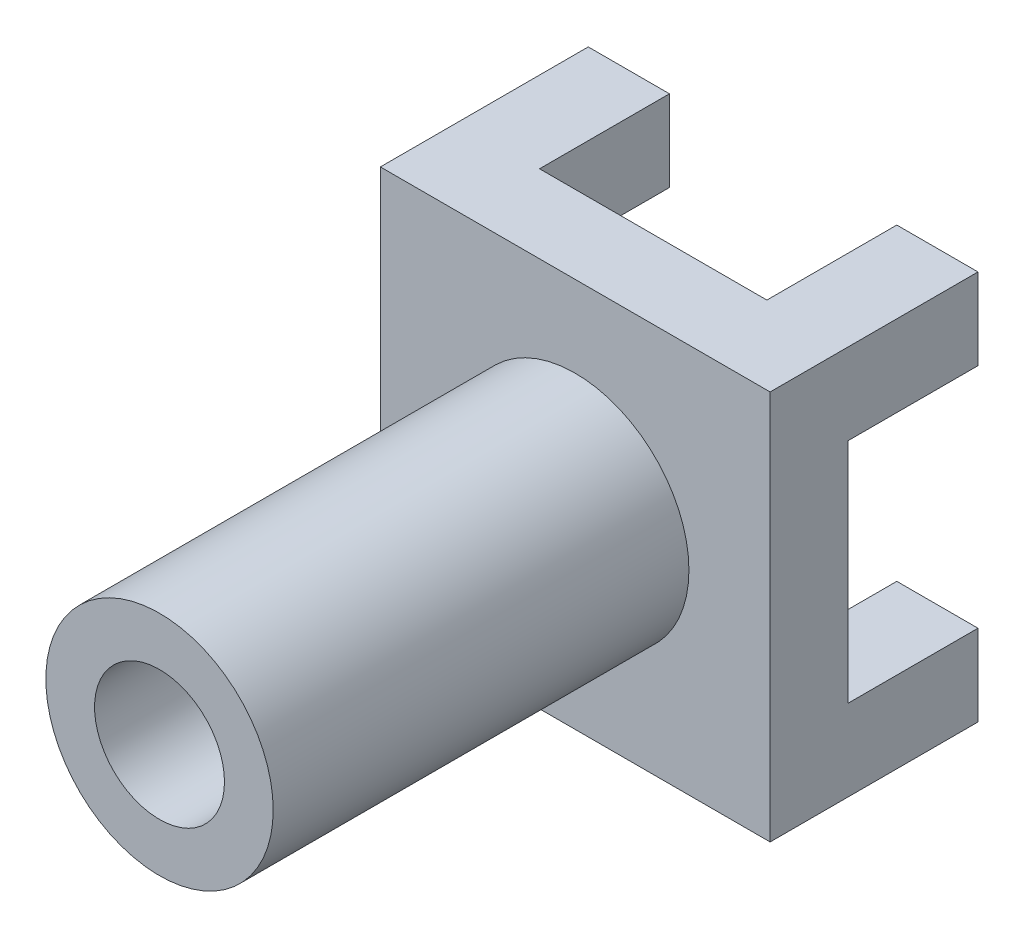
from build123d import *

# Parameters (mm, degrees)
CROQUIS1_W              = 60
CROQUIS1_H              = 60
SALIENTE_EXTRUIR1_DEPTH = 12
CROQUIS2_R              = 17.5
SALIENTE_EXTRUIR2_DEPTH = 64
CROQUIS7_R              = 10
CORTAR_EXTRUIR1_DEPTH   = 76
CROQUIS8_W              = 12.5
CROQUIS8_H              = 12.5
SALIENTE_EXTRUIR3_DEPTH = 20
CROQUIS11_W             = 12.5
CROQUIS11_H             = 12.5
SALIENTE_EXTRUIR5_DEPTH = 20
CROQUIS12_W             = 12.5
CROQUIS12_H             = 12.5
SALIENTE_EXTRUIR6_DEPTH = 20
CROQUIS9_W              = 12.5
CROQUIS9_H              = 12.5
SALIENTE_EXTRUIR9_DEPTH = 20


with BuildPart() as part:
    # Croquis1 → Saliente-Extruir1 (new body)
    with BuildSketch(Plane.XY):
        with Locations((30, 30)):
            Rectangle(CROQUIS1_W, CROQUIS1_H)
    extrude(amount=-SALIENTE_EXTRUIR1_DEPTH)

    # Croquis2 → Saliente-Extruir2 (add)
    with BuildSketch(Plane.XY):
        with Locations((30, 30)):
            Circle(CROQUIS2_R)
    extrude(amount=SALIENTE_EXTRUIR2_DEPTH)

    # Croquis7 → Cortar-Extruir1 (cut)
    with BuildSketch(Plane.XY.offset(64)):
        with Locations((30, 30)):
            Circle(CROQUIS7_R)
    extrude(amount=-CORTAR_EXTRUIR1_DEPTH, mode=Mode.SUBTRACT)

    # Croquis8 → Saliente-Extruir3 (add)
    with BuildSketch(Plane(origin=(0, 0, -12), x_dir=(-1, 0, 0), z_dir=(0, 0, -1))):
        with Locations((-53.75, 53.75)):
            Rectangle(CROQUIS8_W, CROQUIS8_H)
    extrude(amount=SALIENTE_EXTRUIR3_DEPTH)

    # Croquis11 → Saliente-Extruir5 (add)
    with BuildSketch(Plane(origin=(0, 0, -12), x_dir=(-1, 0, 0), z_dir=(0, 0, -1))):
        with Locations((-53.75, 6.25)):
            Rectangle(CROQUIS11_W, CROQUIS11_H)
    extrude(amount=SALIENTE_EXTRUIR5_DEPTH)

    # Croquis12 → Saliente-Extruir6 (add)
    with BuildSketch(Plane(origin=(0, 0, -12), x_dir=(-1, 0, 0), z_dir=(0, 0, -1))):
        with Locations((-6.25, 53.75)):
            Rectangle(CROQUIS12_W, CROQUIS12_H)
    extrude(amount=SALIENTE_EXTRUIR6_DEPTH)

    # Croquis9 → Saliente-Extruir9 (add)
    with BuildSketch(Plane(origin=(0, 0, -32), x_dir=(-1, 0, 0), z_dir=(0, 0, -1))):
        with Locations((-6.25, 6.25)):
            Rectangle(CROQUIS9_W, CROQUIS9_H)
    extrude(amount=-SALIENTE_EXTRUIR9_DEPTH)


solid = part.part
